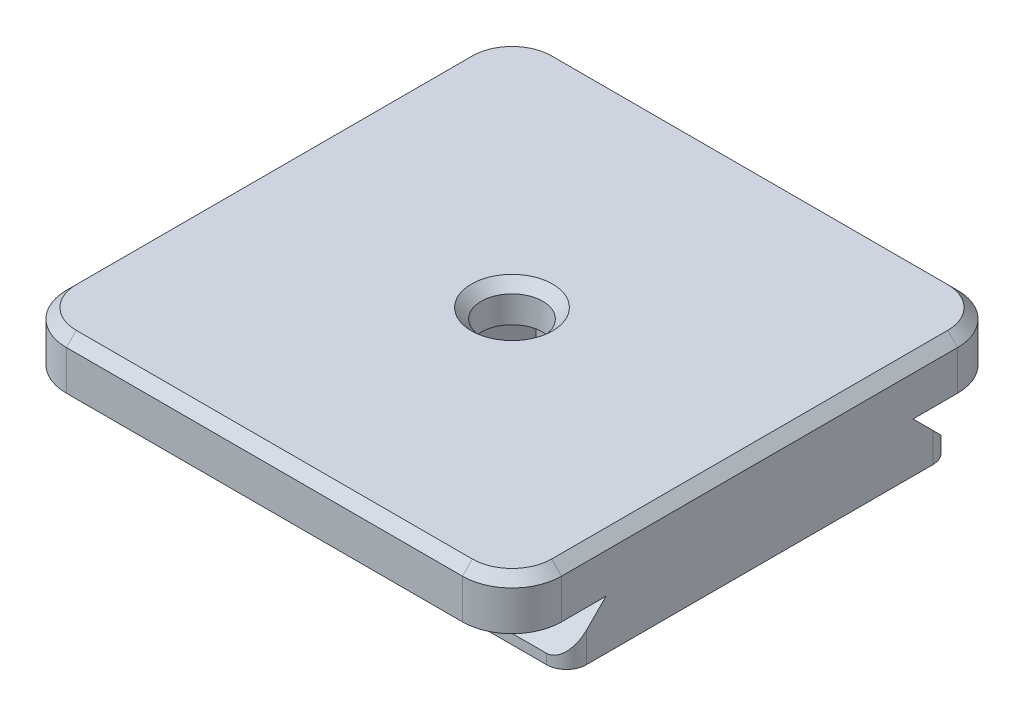
from build123d import *

# Parameters (mm, degrees)
SKETCH1_W           = 50
SKETCH1_H           = 50
BOSS_EXTRUDE1_DEPTH = 10
CUT_EXTRUDE3_DEPTH  = 6.3
SKETCH5_R           = 9
SKETCH5_R_2         = 3.1
BOSS_EXTRUDE2_DEPTH = 6
SKETCH6_R           = 2.7
BOSS_EXTRUDE3_DEPTH = 2.5
FILLET1_R           = 0.5
CUT_EXTRUDE4_DEPTH  = 57.789083458
FILLET2_R           = 5
CHAMFER1_SIZE       = 1
CHAMFER2_SIZE       = 1
CHAMFER2_SIZE2      = 1.414213562
FILLET3_R           = 2
SKETCH9_R           = 3.1
CUT_EXTRUDE5_DEPTH  = 37.434050008
CHAMFER3_SIZE       = 1
CUT_EXTRUDE6_DEPTH  = 6
FILLET4_R           = 3


with BuildPart() as part:
    # Sketch1 → Boss-Extrude1 (new body)
    with BuildSketch(Plane(origin=(0, 0, 0), x_dir=(1, 0, 0), z_dir=(0, 1, 0))):
        Rectangle(SKETCH1_W, SKETCH1_H)
    extrude(amount=BOSS_EXTRUDE1_DEPTH)

    # Sketch4 → Cut-Extrude3 (cut)
    with BuildSketch(Plane(origin=(0, 0, 0), x_dir=(-1, 0, 0), z_dir=(0, -1, 0))):
        with BuildLine():
            Line((21, -7.228416147), (21, -10.5))
            ThreePointArc((21, -10.5), (20.267766953, -12.267766953), (18.5, -13))
            Line((18.5, -13), (-18.5, -13))
            ThreePointArc((-18.5, -13), (-20.267766953, -12.267766953), (-21, -10.5))
            Line((-21, -10.5), (-21, -7.228416147))
            ThreePointArc((-21, -7.228416147), (-20.591644852, -6.017356006), (-19.533333333, -5.300838508))
            ThreePointArc((-19.533333333, -5.300838508), (-15.5, 0), (-19.533333333, 5.300838508))
            ThreePointArc((-19.533333333, 5.300838508), (-20.591644852, 6.017356006), (-21, 7.228416147))
            Line((-21, 7.228416147), (-21, 10.5))
            ThreePointArc((-21, 10.5), (-20.267766953, 12.267766953), (-18.5, 13))
            Line((-18.5, 13), (18.5, 13))
            ThreePointArc((18.5, 13), (20.267766953, 12.267766953), (21, 10.5))
            Line((21, 10.5), (21, 7.228416147))
            ThreePointArc((21, 7.228416147), (20.591644852, 6.017356006), (19.533333333, 5.300838508))
            ThreePointArc((19.533333333, 5.300838508), (15.5, 0), (19.533333333, -5.300838508))
            ThreePointArc((19.533333333, -5.300838508), (20.591644852, -6.017356006), (21, -7.228416147))
        make_face()
    extrude(amount=-CUT_EXTRUDE3_DEPTH, mode=Mode.SUBTRACT)

    # Sketch5 → Boss-Extrude2 (add)
    with BuildSketch(Plane(origin=(0, 6.3, 0), x_dir=(-1, 0, 0), z_dir=(0, -1, 0))):
        with Locations(Location((0, 0, 0), (0, 0, 90))):
            Circle(SKETCH5_R)
        with Locations(Location((0, 0, 0), (0, 0, 90))):
            Circle(SKETCH5_R_2, mode=Mode.SUBTRACT)
    extrude(amount=BOSS_EXTRUDE2_DEPTH)

    # Sketch6 → Boss-Extrude3 (add)
    with BuildSketch(Plane.XZ):
        with Locations(Location((-20, 0, 0), (0, 0, 90))):
            Circle(SKETCH6_R)
        with Locations(Location((20, 0, 0), (0, 0, 90))):
            Circle(SKETCH6_R)
    extrude(amount=BOSS_EXTRUDE3_DEPTH)

    # Fillet1
    fillet1_edges = [part.edges().sort_by_distance(p)[0] for p in [
        (-20, -2.5, -2.7),
        (20, -2.5, -2.7),
    ]]
    fillet(fillet1_edges, radius=FILLET1_R)

    # Sketch8 → Cut-Extrude4 (cut, through all)
    with BuildSketch(Plane(origin=(25, 0, 0), x_dir=(0, 0, -1), z_dir=(1, 0, 0))):
        Polygon((-25, 0), (-25, 5), (-15.5, 5), (-20.5, 0), align=None)
        Polygon((25, 0), (25, 5), (15.5, 5), (20.5, 0), align=None)
    extrude(amount=-CUT_EXTRUDE4_DEPTH, mode=Mode.SUBTRACT)

    # Fillet2
    fillet2_edges = [part.edges().sort_by_distance(p)[0] for p in [
        (-25, 7.5, -25),
        (25, 7.5, -25),
        (25, 7.5, 25),
        (-25, 7.5, 25),
    ]]
    fillet(fillet2_edges, radius=FILLET2_R)

    # Chamfer1
    chamfer1_edges = [part.edges().sort_by_distance(p)[0] for p in [
        (0, 10, -25),
        (25, 10, 0),
        (-25, 10, 0),
        (0, 10, 25),
        (23.535533906, 10, 23.535533906),
        (-23.535533906, 10, 23.535533906),
        (-23.535533906, 10, -23.535533906),
        (23.535533906, 10, -23.535533906),
    ]]
    chamfer(chamfer1_edges, length=CHAMFER1_SIZE)

    # Chamfer2
    chamfer2_edges = [part.edges().sort_by_distance(p)[0] for p in [
        (0, 0, 20.5),
        (0, 0, -20.5),
    ]]
    chamfer2_side = [part.faces().sort_by_distance(p)[0] for p in [
        (24.353393474, 0, 0),
    ]]
    chamfer(chamfer2_edges, length=CHAMFER2_SIZE, length2=CHAMFER2_SIZE2, reference=chamfer2_side[0])

    # Fillet3
    fillet3_edges = [part.edges().sort_by_distance(p)[0] for p in [
        (25, 0.5, -19.5),
        (25, 0.5, 19.5),
        (-25, 0.5, -19.5),
        (-25, 0.5, 19.5),
    ]]
    fillet(fillet3_edges, radius=FILLET3_R)

    # Sketch9 → Cut-Extrude5 (cut, through all)
    with BuildSketch(Plane(origin=(0, 6.3, 0), x_dir=(-1, 0, 0), z_dir=(0, -1, 0))):
        with Locations(Location((0, 0, 0), (0, 0, 90))):
            Circle(SKETCH9_R)
    extrude(amount=-CUT_EXTRUDE5_DEPTH, mode=Mode.SUBTRACT)

    # Chamfer3
    chamfer3_edges = [part.edges().sort_by_distance(p)[0] for p in [
        (0, 10, 3.1),
    ]]
    chamfer(chamfer3_edges, length=CHAMFER3_SIZE)

    # Sketch10 → Cut-Extrude6 (cut)
    with BuildSketch(Plane(origin=(0, 0.3, 0), x_dir=(-1, 0, 0), z_dir=(0, -1, 0))):
        Polygon((3.31, -5.733088173), (6.62, 0), (3.31, 5.733088173), (-3.31, 5.733088173), (-6.62, 0), (-3.31, -5.733088173), align=None)
    extrude(amount=-CUT_EXTRUDE6_DEPTH, mode=Mode.SUBTRACT)

    # Fillet4
    fillet4_edges = [part.edges().sort_by_distance(p)[0] for p in [
        (0, 6.3, 9),
    ]]
    fillet(fillet4_edges, radius=FILLET4_R)


solid = part.part
